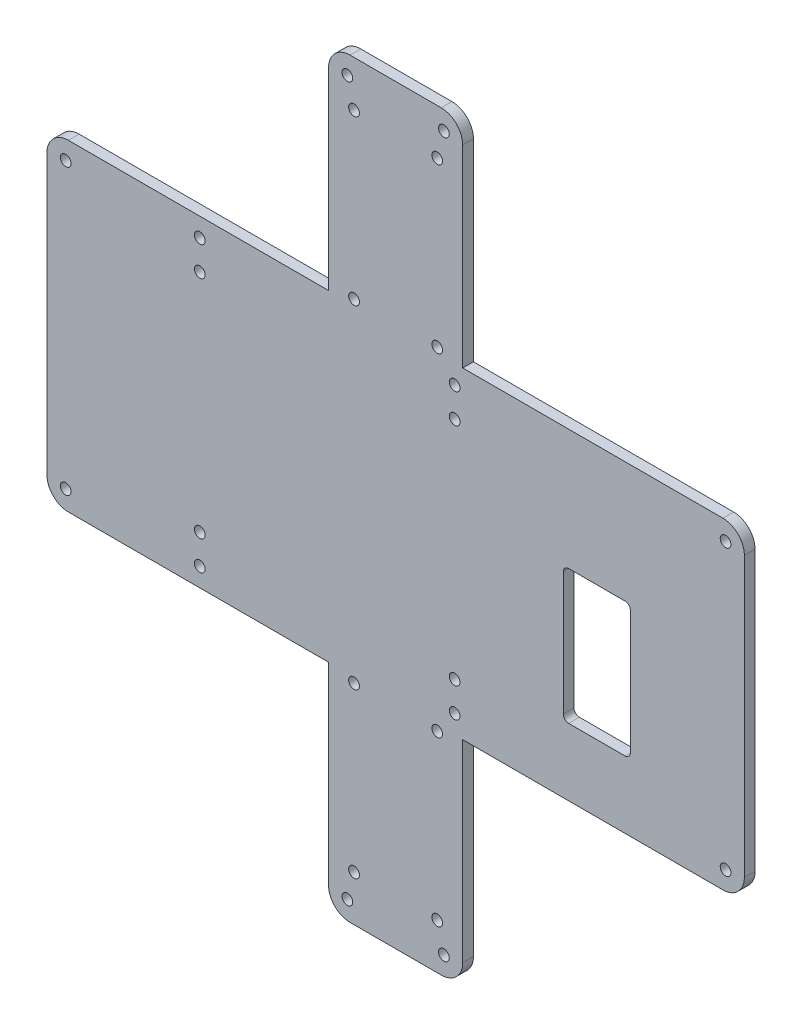
from build123d import *

# Parameters (mm, degrees)
SKETCH_2_W      = 25
SKETCH_2_H      = 50
SKETCH_2_R      = 2
EXTRUDE_1_DEPTH = 4
FILLET_1_R      = 8
FILLET_2_R      = 2


with BuildPart() as part:
    # 草图2 → 凸台-拉伸1 (new body)
    with BuildSketch(Plane.XY):
        Polygon((-39.472146663, 69.287551935), (-144.472146663, 69.287551935), (-144.472146663, -50.712448065), (-39.472146663, -50.712448065), (-39.472146663, -130.712448065), (10.527853337, -130.712448065), (10.527853337, -50.712448065), (115.527853337, -50.712448065), (115.527853337, 69.287551935), (10.527853337, 69.287551935), (10.527853337, 149.287551935), (-39.472146663, 149.287551935), align=None)
        with Locations((60.527853337, -0.712448065)):
            Rectangle(SKETCH_2_W, SKETCH_2_H, mode=Mode.SUBTRACT)
        with Locations((-87.472146663, -43.712448065)):
            Circle(SKETCH_2_R, mode=Mode.SUBTRACT)
        with Locations((-87.472146663, -32.712448065)):
            Circle(SKETCH_2_R, mode=Mode.SUBTRACT)
        with Locations((7.527853337, -32.712448065)):
            Circle(SKETCH_2_R, mode=Mode.SUBTRACT)
        with Locations((7.527853337, -43.712448065)):
            Circle(SKETCH_2_R, mode=Mode.SUBTRACT)
        with Locations((7.527853337, 51.287551935)):
            Circle(SKETCH_2_R, mode=Mode.SUBTRACT)
        with Locations((7.527853337, 62.287551935)):
            Circle(SKETCH_2_R, mode=Mode.SUBTRACT)
        with Locations((-87.472146663, 51.287551935)):
            Circle(SKETCH_2_R, mode=Mode.SUBTRACT)
        with Locations((-87.472146663, 62.287551935)):
            Circle(SKETCH_2_R, mode=Mode.SUBTRACT)
        with Locations((-137.472146663, 62.287551935)):
            Circle(SKETCH_2_R, mode=Mode.SUBTRACT)
        with Locations((-137.472146663, -43.712448065)):
            Circle(SKETCH_2_R, mode=Mode.SUBTRACT)
        with Locations((-29.972146663, 132.287551935)):
            Circle(SKETCH_2_R, mode=Mode.SUBTRACT)
        with Locations((1.027853337, 132.287551935)):
            Circle(SKETCH_2_R, mode=Mode.SUBTRACT)
        with Locations((1.027853337, 71.287551935)):
            Circle(SKETCH_2_R, mode=Mode.SUBTRACT)
        with Locations((-29.972146663, 71.287551935)):
            Circle(SKETCH_2_R, mode=Mode.SUBTRACT)
        with Locations((3.527853337, 142.287551935)):
            Circle(SKETCH_2_R, mode=Mode.SUBTRACT)
        with Locations((-32.472146663, 142.287551935)):
            Circle(SKETCH_2_R, mode=Mode.SUBTRACT)
        with Locations((108.527853337, 62.287551935)):
            Circle(SKETCH_2_R, mode=Mode.SUBTRACT)
        with Locations((108.527853337, -43.712448065)):
            Circle(SKETCH_2_R, mode=Mode.SUBTRACT)
        with Locations((1.027853337, -52.712448065)):
            Circle(SKETCH_2_R, mode=Mode.SUBTRACT)
        with Locations((3.527853337, -123.712448065)):
            Circle(SKETCH_2_R, mode=Mode.SUBTRACT)
        with Locations((-32.472146663, -123.712448065)):
            Circle(SKETCH_2_R, mode=Mode.SUBTRACT)
        with Locations((-29.972146663, -113.712448065)):
            Circle(SKETCH_2_R, mode=Mode.SUBTRACT)
        with Locations((-29.972146663, -52.712448065)):
            Circle(SKETCH_2_R, mode=Mode.SUBTRACT)
        with Locations((1.027853337, -113.712448065)):
            Circle(SKETCH_2_R, mode=Mode.SUBTRACT)
    extrude(amount=EXTRUDE_1_DEPTH)

    # 圆角1
    fillet_1_edges = [part.edges().sort_by_distance(p)[0] for p in [
        (10.527853337, -130.712448065, 2),
        (-39.472146663, -130.712448065, 2),
        (-144.472146663, -50.712448065, 2),
        (-144.472146663, 69.287551935, 2),
        (-39.472146663, 149.287551935, 2),
        (10.527853337, 149.287551935, 2),
        (115.527853337, 69.287551935, 2),
        (115.527853337, -50.712448065, 2),
    ]]
    fillet(fillet_1_edges, radius=FILLET_1_R)

    # 圆角2
    fillet_2_edges = [part.edges().sort_by_distance(p)[0] for p in [
        (73.027853337, -25.712448065, 2),
        (73.027853337, 24.287551935, 2),
        (48.027853337, 24.287551935, 2),
        (48.027853337, -25.712448065, 2),
    ]]
    fillet(fillet_2_edges, radius=FILLET_2_R)


solid = part.part
